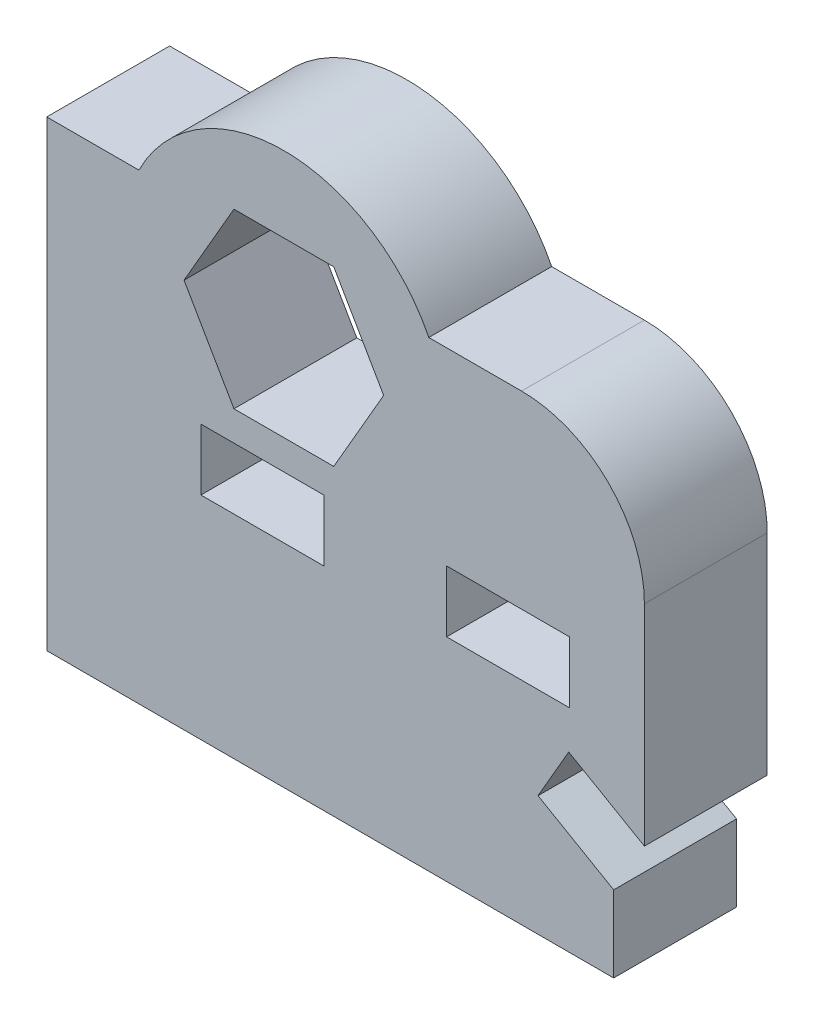
from build123d import *

# Parameters (mm, degrees)
SKETCH1_W           = 4
SKETCH1_H           = 2
BOSS_EXTRUDE1_DEPTH = 4


with BuildPart() as part:
    # Sketch1 → Boss-Extrude1 (new body)
    with BuildSketch(Plane.XY):
        with BuildLine():
            Line((14.475572066, 6), (15.475572066, 7.732050808))
            Line((15.475572066, 7.732050808), (17.939673681, 6.309401077))
            Line((17.939673681, 6.309401077), (17.939673681, 13.142551265))
            ThreePointArc((17.939673681, 13.142551265), (16.768100806, 15.97097839), (13.939673681, 17.142551265))
            Line((13.939673681, 17.142551265), (10.920326319, 17.142551265))
            ThreePointArc((10.920326319, 17.142551265), (6.2, 20.055557209), (1.479673681, 17.142551265))
            Line((1.479673681, 17.142551265), (-1.520326319, 17.142551265))
            Line((-1.520326319, 17.142551265), (-1.520326319, 2.09107808))
            Line((-1.520326319, 2.09107808), (16.939673681, 2.09107808))
            Line((16.939673681, 2.09107808), (16.939673681, 4.577350269))
            Line((16.939673681, 4.577350269), (14.475572066, 6))
        make_face()
        with Locations((5.5, 9.99107808)):
            Rectangle(SKETCH1_W, SKETCH1_H, mode=Mode.SUBTRACT)
        with Locations((13.5, 9.99107808)):
            Rectangle(SKETCH1_W, SKETCH1_H, mode=Mode.SUBTRACT)
        Polygon((2.95, 14.774571729), (4.575, 11.959989167), (7.825, 11.959989167), (9.45, 14.774571729), (7.825, 17.589154291), (4.575, 17.589154291), align=None, mode=Mode.SUBTRACT)
    extrude(amount=BOSS_EXTRUDE1_DEPTH)


solid = part.part
